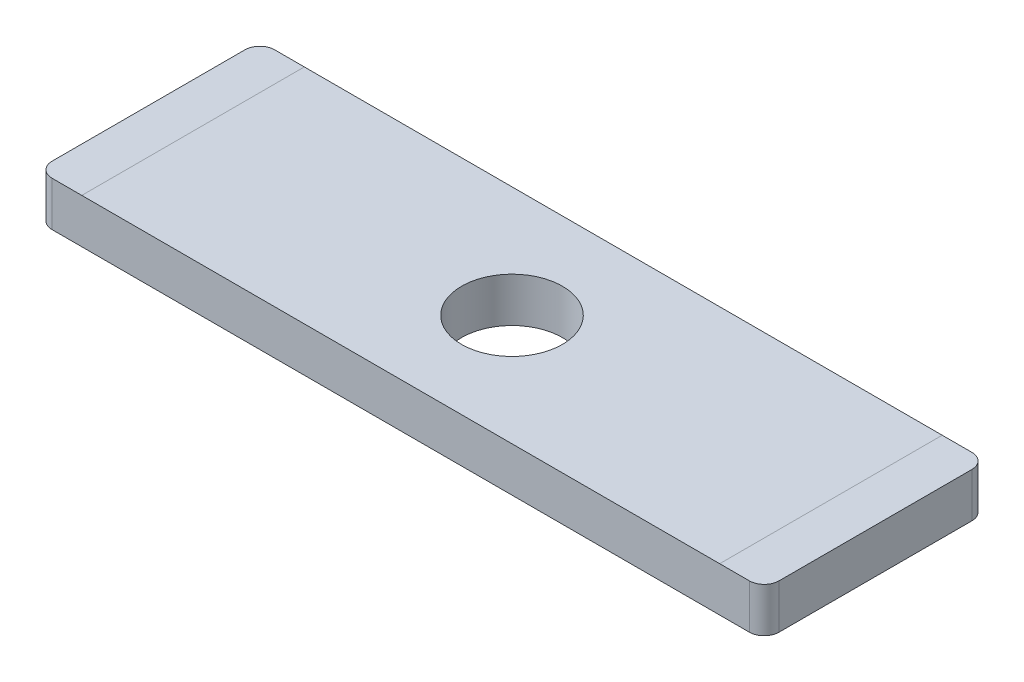
from build123d import *

# Parameters (mm, degrees)
SKETCH1_W           = 49
SKETCH1_H           = 15
BOSS_EXTRUDE1_DEPTH = 3
SKETCH2_R           = 3.4
CUT_EXTRUDE1_DEPTH  = 26.797286679
FILLET1_R           = 1


with BuildPart() as part:
    # Sketch1 → Boss-Extrude1 (new body)
    with BuildSketch(Plane(origin=(0, 0, 0), x_dir=(1, 0, 0), z_dir=(0, 1, 0))):
        Rectangle(SKETCH1_W, SKETCH1_H)
    extrude(amount=BOSS_EXTRUDE1_DEPTH)

    # Sketch2 → Cut-Extrude1 (cut, through all)
    with BuildSketch(Plane(origin=(0, 3, 0), x_dir=(1, 0, 0), z_dir=(0, 1, 0))):
        with Locations(Location((0, 0, 0), (0, 0, 270))):
            Circle(SKETCH2_R)
    extrude(amount=-CUT_EXTRUDE1_DEPTH, mode=Mode.SUBTRACT)

    # Fillet1
    fillet1_edges = [part.edges().sort_by_distance(p)[0] for p in [
        (-24.5, 1.5, -7.5),
        (24.5, 1.5, -7.5),
        (24.5, 1.5, 7.5),
        (-24.5, 1.5, 7.5),
    ]]
    fillet(fillet1_edges, radius=FILLET1_R)


solid = part.part
